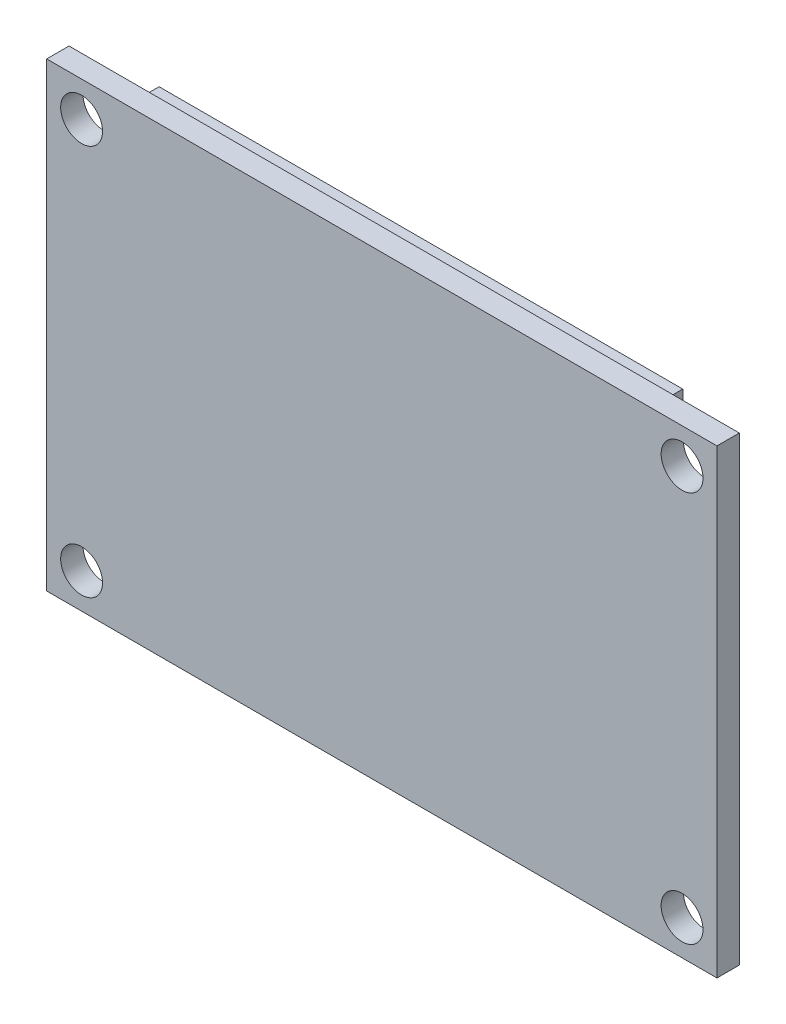
from build123d import *

# Parameters (mm, degrees)
BASE_PCB_W              = 48
BASE_PCB_H              = 33
BASE_PCB_R              = 1.5
BOSS_EXTRU_1_DEPTH      = 1.6
ESQUISSE4_W             = 37.5
ESQUISSE4_H             = 32
BOSS_EXTRU_2_DEPTH      = 1.2
ESQUISSE5_W             = 27.6
ESQUISSE5_H             = 27.6
ENL_V_MAT_EXTRU_2_DEPTH = 0.5


with BuildPart() as part:
    # BASE PCB → Boss.-Extru.1 (new body)
    with BuildSketch(Plane.XY):
        Rectangle(BASE_PCB_W, BASE_PCB_H)
        with Locations((-21.5, 14)):
            Circle(BASE_PCB_R, mode=Mode.SUBTRACT)
        with Locations((-21.5, -14)):
            Circle(BASE_PCB_R, mode=Mode.SUBTRACT)
        with Locations(Location((21.5, -14, 0), (0, 0, 180))):
            Circle(BASE_PCB_R, mode=Mode.SUBTRACT)
        with Locations(Location((21.5, 14, 0), (0, 0, 180))):
            Circle(BASE_PCB_R, mode=Mode.SUBTRACT)
    extrude(amount=BOSS_EXTRU_1_DEPTH)

    # Esquisse4 → Boss.-Extru.2 (add)
    with BuildSketch(Plane.XY):
        Rectangle(ESQUISSE4_W, ESQUISSE4_H)
    extrude(amount=-BOSS_EXTRU_2_DEPTH)

    # Esquisse5 → Enlèv. mat.-Extru.2 (cut)
    with BuildSketch(Plane(origin=(0, 0, -1.2), x_dir=(-1, 0, 0), z_dir=(0, 0, -1))):
        with Locations((-2.95, 0)):
            Rectangle(ESQUISSE5_W, ESQUISSE5_H)
    extrude(amount=-ENL_V_MAT_EXTRU_2_DEPTH, mode=Mode.SUBTRACT)


solid = part.part
